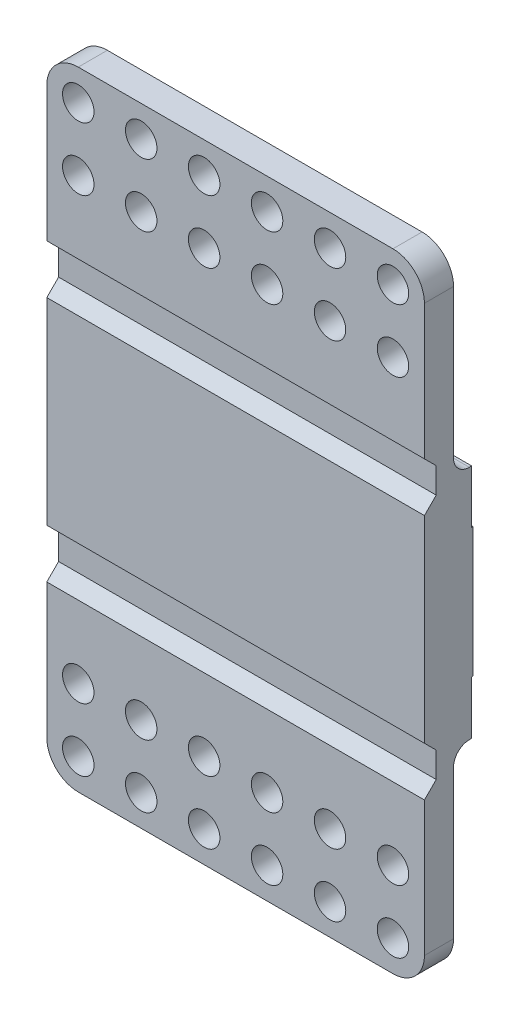
from build123d import *

# Parameters (mm, degrees)
BOSS_EXTRU_1_DEPTH         = 3.7
ESQUISSE2_R                = 2
ENL_V_MAT_EXTRU_1_DEPTH    = 47.708671572
R_P_TITION_LIN_AIRE1_COUNT = 6
R_P_TITION_LIN_AIRE1_PITCH = 8
SYM_TRIE1_COPY_1_SKETCH_R  = 2
SYM_TRIE1_COPY_1_DEPTH     = 47.708671572
SYM_TRIE1_COPY_2_SKETCH_R  = 2
SYM_TRIE1_COPY_2_DEPTH     = 47.708671572
SYM_TRIE1_COPY_3_SKETCH_R  = 2
SYM_TRIE1_COPY_3_DEPTH     = 47.708671572
SYM_TRIE1_COPY_4_SKETCH_R  = 2
SYM_TRIE1_COPY_4_DEPTH     = 47.708671572
SYM_TRIE1_COPY_5_SKETCH_R  = 2
SYM_TRIE1_COPY_5_DEPTH     = 47.708671572
ESQUISSE3_W                = 2.3
ESQUISSE3_H                = 15
BOSS_EXTRU_2_DEPTH         = 24
CONG_1_R                   = 2
CONG_1_OF_SYM_TRIE2_R      = 2
ENL_V_MAT_EXTRU_2_DEPTH    = 63.527593909
ESQUISSE5_W                = 0.2
ESQUISSE5_H                = 16.438402163
BOSS_EXTRU_3_DEPTH         = 48


with BuildPart() as part:
    # Esquisse1 → Boss.-Extru.1 (new body)
    with BuildSketch(Plane.XY):
        with BuildLine():
            Line((-20, 39.9), (20, 39.9))
            ThreePointArc((20, 39.9), (22.828427125, 38.728427125), (24, 35.9))
            Line((24, 35.9), (24, -35.9))
            ThreePointArc((24, -35.9), (22.828427125, -38.728427125), (20, -39.9))
            Line((20, -39.9), (-20, -39.9))
            ThreePointArc((-20, -39.9), (-22.828427125, -38.728427125), (-24, -35.9))
            Line((-24, -35.9), (-24, 35.9))
            ThreePointArc((-24, 35.9), (-22.828427125, 38.728427125), (-20, 39.9))
        make_face()
    extrude(amount=BOSS_EXTRU_1_DEPTH)

    # Esquisse2 → Enlèv. mat.-Extru.1 (cut, through all)
    with BuildSketch(Plane.XY.offset(3.7)):
        with Locations((20, 35.97)):
            Circle(ESQUISSE2_R)
        with Locations((20, 27.97)):
            Circle(ESQUISSE2_R)
    enl_v_mat_extru_1 = extrude(amount=-ENL_V_MAT_EXTRU_1_DEPTH, mode=Mode.SUBTRACT)

    # Répétition linéaire1: Enlèv. mat.-Extru.1 ×6
    with Locations(*[(-i * R_P_TITION_LIN_AIRE1_PITCH, 0, 0) for i in range(1, R_P_TITION_LIN_AIRE1_COUNT)]):
        add(enl_v_mat_extru_1, mode=Mode.SUBTRACT)

    # Symétrie1: Enlèv. mat.-Extru.1 across plane
    add(enl_v_mat_extru_1.mirror(Plane.ZX), mode=Mode.SUBTRACT)

    # Symétrie1 copy 1 sketch → Symétrie1 copy 1 (cut, through all)
    with BuildSketch(Plane(origin=(-8, 0, 3.7), x_dir=(1, 0, 0), z_dir=(0, 0, 1))):
        with Locations((20, -35.97)):
            Circle(SYM_TRIE1_COPY_1_SKETCH_R)
        with Locations((20, -27.97)):
            Circle(SYM_TRIE1_COPY_1_SKETCH_R)
    extrude(amount=-SYM_TRIE1_COPY_1_DEPTH, mode=Mode.SUBTRACT)

    # Symétrie1 copy 2 sketch → Symétrie1 copy 2 (cut, through all)
    with BuildSketch(Plane(origin=(-16, 0, 3.7), x_dir=(1, 0, 0), z_dir=(0, 0, 1))):
        with Locations((20, -35.97)):
            Circle(SYM_TRIE1_COPY_2_SKETCH_R)
        with Locations((20, -27.97)):
            Circle(SYM_TRIE1_COPY_2_SKETCH_R)
    extrude(amount=-SYM_TRIE1_COPY_2_DEPTH, mode=Mode.SUBTRACT)

    # Symétrie1 copy 3 sketch → Symétrie1 copy 3 (cut, through all)
    with BuildSketch(Plane(origin=(-24, 0, 3.7), x_dir=(1, 0, 0), z_dir=(0, 0, 1))):
        with Locations((20, -35.97)):
            Circle(SYM_TRIE1_COPY_3_SKETCH_R)
        with Locations((20, -27.97)):
            Circle(SYM_TRIE1_COPY_3_SKETCH_R)
    extrude(amount=-SYM_TRIE1_COPY_3_DEPTH, mode=Mode.SUBTRACT)

    # Symétrie1 copy 4 sketch → Symétrie1 copy 4 (cut, through all)
    with BuildSketch(Plane(origin=(-32, 0, 3.7), x_dir=(1, 0, 0), z_dir=(0, 0, 1))):
        with Locations((20, -35.97)):
            Circle(SYM_TRIE1_COPY_4_SKETCH_R)
        with Locations((20, -27.97)):
            Circle(SYM_TRIE1_COPY_4_SKETCH_R)
    extrude(amount=-SYM_TRIE1_COPY_4_DEPTH, mode=Mode.SUBTRACT)

    # Symétrie1 copy 5 sketch → Symétrie1 copy 5 (cut, through all)
    with BuildSketch(Plane(origin=(-40, 0, 3.7), x_dir=(1, 0, 0), z_dir=(0, 0, 1))):
        with Locations((20, -35.97)):
            Circle(SYM_TRIE1_COPY_5_SKETCH_R)
        with Locations((20, -27.97)):
            Circle(SYM_TRIE1_COPY_5_SKETCH_R)
    extrude(amount=-SYM_TRIE1_COPY_5_DEPTH, mode=Mode.SUBTRACT)

    # Esquisse3 → Boss.-Extru.2 (add, symmetric)
    with BuildSketch(Plane(origin=(0, 0, 0), x_dir=(0, 0, -1), z_dir=(1, 0, 0))):
        with Locations((1.15, 7.5)):
            Rectangle(ESQUISSE3_W, ESQUISSE3_H)
    boss_extru_2 = extrude(amount=BOSS_EXTRU_2_DEPTH, both=True)

    # Congé1
    cong_1_edges = [part.edges().sort_by_distance(p)[0] for p in [
        (0, 15, 0),
    ]]
    fillet(cong_1_edges, radius=CONG_1_R)

    # Symétrie2: Boss.-Extru.2 across plane
    add(boss_extru_2.mirror(Plane.ZX))

    # Congé1 of Symétrie2
    cong_1_of_sym_trie2_edges = [part.edges().sort_by_distance(p)[0] for p in [
        (0, -15, 0),
    ]]
    fillet(cong_1_of_sym_trie2_edges, radius=CONG_1_OF_SYM_TRIE2_R)

    # Esquisse4 → Enlèv. mat.-Extru.2 (cut, through all)
    with BuildSketch(Plane.ZY.offset(24)):
        Polygon((3.7, 18.775233884), (2.2, 17.275233884), (2.2, 14.031809695), (3.7, 12.531809695), align=None)
    enl_v_mat_extru_2 = extrude(amount=-ENL_V_MAT_EXTRU_2_DEPTH, mode=Mode.SUBTRACT)

    # Symétrie3: Enlèv. mat.-Extru.2 across plane
    add(enl_v_mat_extru_2.mirror(Plane.ZX), mode=Mode.SUBTRACT)

    # Esquisse5 → Boss.-Extru.3 (add, through all)
    with BuildSketch(Plane(origin=(24, 0, 0), x_dir=(0, 0, -1), z_dir=(1, 0, 0))):
        with Locations((2.4, -0.002043793)):
            Rectangle(ESQUISSE5_W, ESQUISSE5_H)
    extrude(amount=-BOSS_EXTRU_3_DEPTH)


solid = part.part
